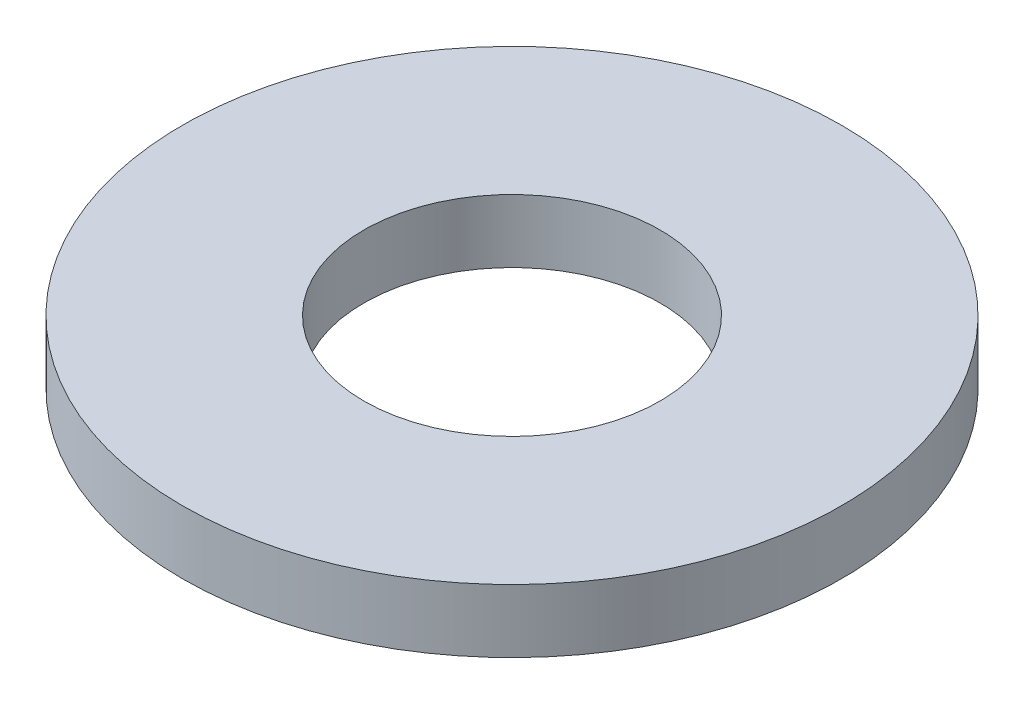
from build123d import *

# Parameters (mm, degrees)
SKETCH1_R           = 7.9375
BOSS_EXTRUDE1_DEPTH = 1.524
SKETCH5_R           = 3.5687
CUT_EXTRUDE1_DEPTH  = 12.328300336


with BuildPart() as part:
    # Sketch1 → Boss-Extrude1 (new body)
    with BuildSketch(Plane(origin=(0, 0, 0), x_dir=(1, 0, 0), z_dir=(0, 1, 0))):
        with Locations(Location((0, 0, 0), (0, 0, 90))):
            Circle(SKETCH1_R)
    extrude(amount=BOSS_EXTRUDE1_DEPTH)

    # Sketch5 → Cut-Extrude1 (cut, through all)
    with BuildSketch(Plane(origin=(0, 1.524, 0), x_dir=(-1, 0, 0), z_dir=(0, 1, 0))):
        with Locations(Location((0, 0, 0), (0, 0, 90))):
            Circle(SKETCH5_R)
    extrude(amount=-CUT_EXTRUDE1_DEPTH, mode=Mode.SUBTRACT)


solid = part.part
